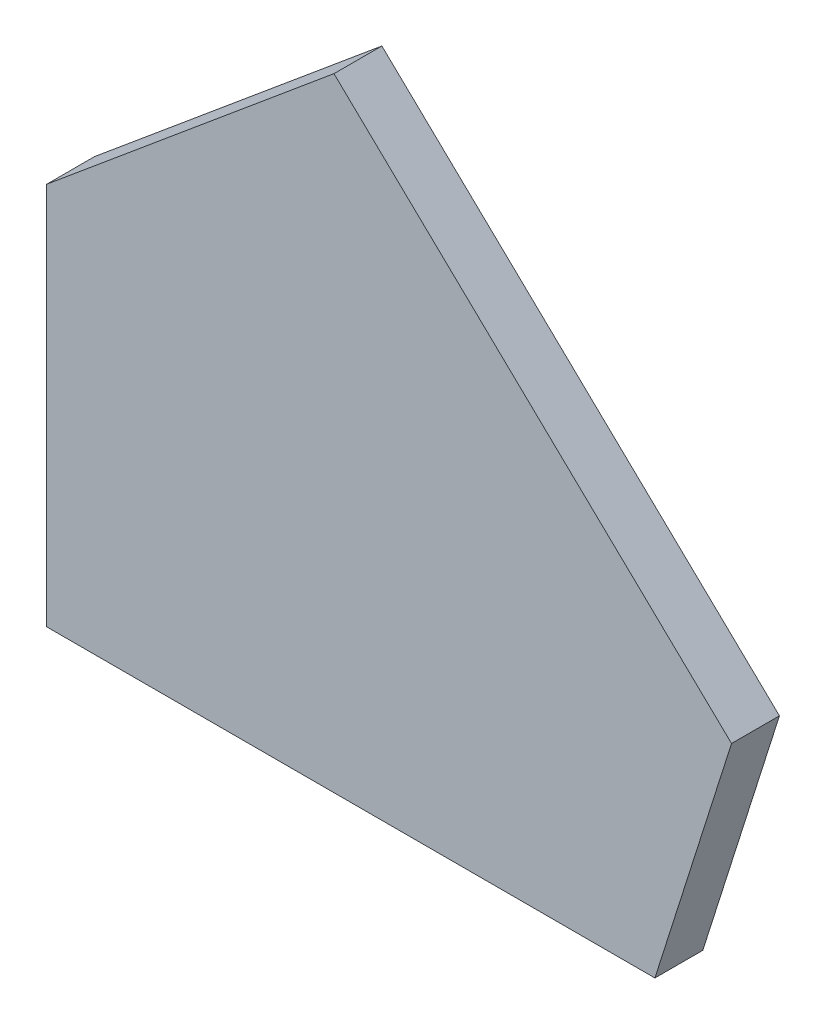
from build123d import *

# Parameters (mm, degrees)
EXTRUDE_1_DEPTH = 1


with BuildPart() as part:
    # Эскиз1 → Бобышка-Вытянуть1 (new body)
    with BuildSketch(Plane(origin=(0, 0, 0), x_dir=(0, -1, 0), z_dir=(0, 0, 1))):
        Polygon((0, -6.35), (0, 6.35), (-5.040100503, 7.95), (-13, -0.35), (-8, -6.35), align=None)
    extrude(amount=EXTRUDE_1_DEPTH)


solid = part.part
